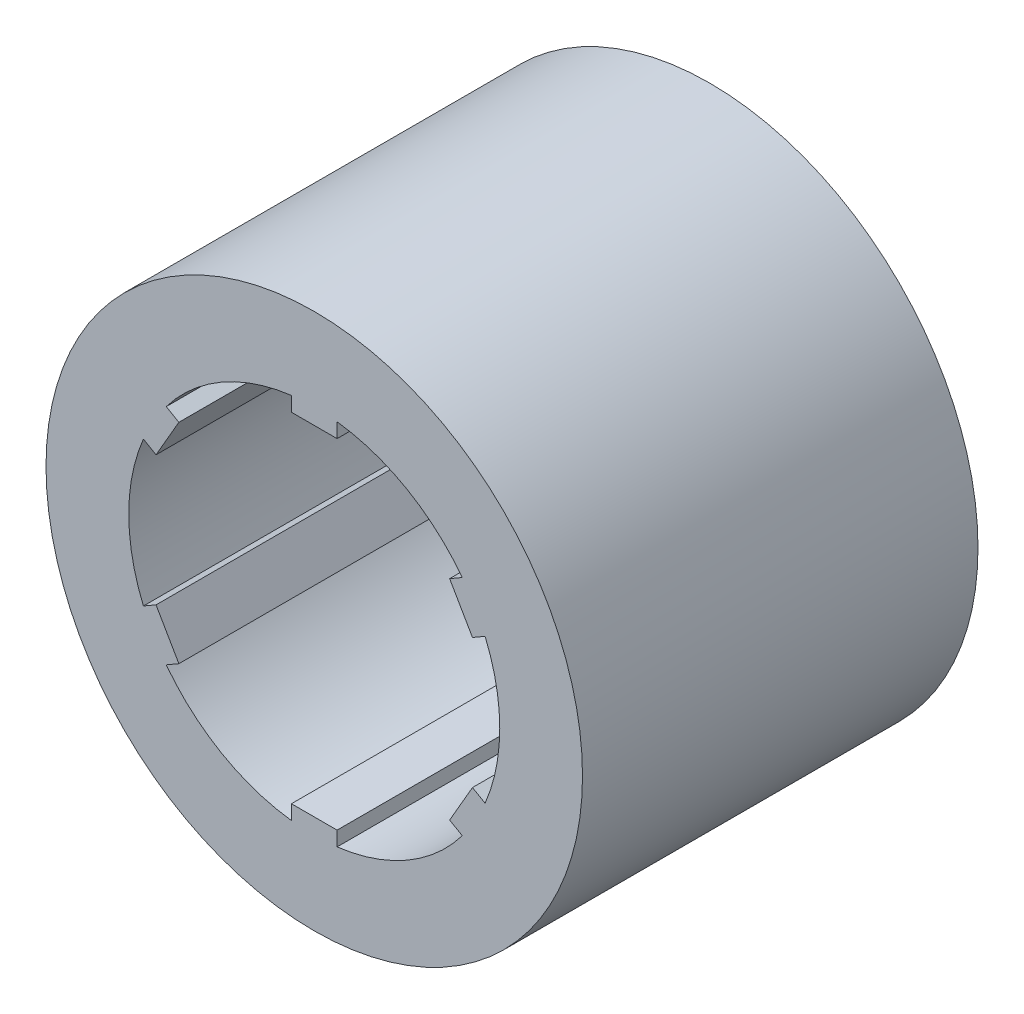
from build123d import *

# Parameters (mm, degrees)
SKETCH_1_R      = 14.9225
EXTRUDE_1_DEPTH = 22


with BuildPart() as part:
    # Эскиз1 → Бобышка-Вытянуть1 (new body)
    with BuildSketch(Plane.XY):
        with Locations((0.26749168, -0.40123752)):
            Circle(SKETCH_1_R)
        with BuildLine():
            Line((9.068894716, -4.016260259), (9.770849808, -4.421534221))
            ThreePointArc((9.770849808, -4.421534221), (10.58624167, -0.401237512), (9.770849811, 3.619059197))
            Line((9.770849811, 3.619059197), (9.068894716, 3.213785234))
            Line((9.068894716, 3.213785234), (7.798894722, 5.413489748))
            Line((7.798894722, 5.413489748), (8.500849816, 5.81876371))
            ThreePointArc((8.500849816, 5.81876371), (5.426866673, 8.535062117), (1.537491677, 9.839060403))
            Line((1.537491677, 9.839060403), (1.537491677, 9.02851248))
            Line((1.537491677, 9.02851248), (-1.002508323, 9.02851248))
            Line((-1.002508323, 9.02851248), (-1.002508323, 9.839060408))
            ThreePointArc((-1.002508323, 9.839060408), (-4.891883323, 8.535062121), (-7.965866467, 5.818763712))
            Line((-7.965866467, 5.818763712), (-7.26391137, 5.413489747))
            Line((-7.26391137, 5.413489747), (-8.533911366, 3.213785229))
            Line((-8.533911366, 3.213785229), (-9.235866458, 3.61905919))
            ThreePointArc((-9.235866458, 3.61905919), (-10.05125832, -0.401237517), (-9.235866461, -4.421534225))
            Line((-9.235866461, -4.421534225), (-8.533911367, -4.016260262))
            Line((-8.533911367, -4.016260262), (-7.263911371, -6.215964781))
            Line((-7.263911371, -6.215964781), (-7.965866465, -6.621238743))
            ThreePointArc((-7.965866465, -6.621238743), (-4.891883323, -9.337537149), (-1.002508328, -10.641535436))
            Line((-1.002508328, -10.641535436), (-1.002508328, -9.830987512))
            Line((-1.002508328, -9.830987512), (1.537491672, -9.830987512))
            Line((1.537491672, -9.830987512), (1.537491672, -10.641535441))
            ThreePointArc((1.537491672, -10.641535441), (5.426866673, -9.337537153), (8.500849818, -6.621238742))
            Line((8.500849818, -6.621238742), (7.79889472, -6.215964777))
            Line((7.79889472, -6.215964777), (9.068894716, -4.016260259))
        make_face(mode=Mode.SUBTRACT)
    extrude(amount=EXTRUDE_1_DEPTH)


solid = part.part
